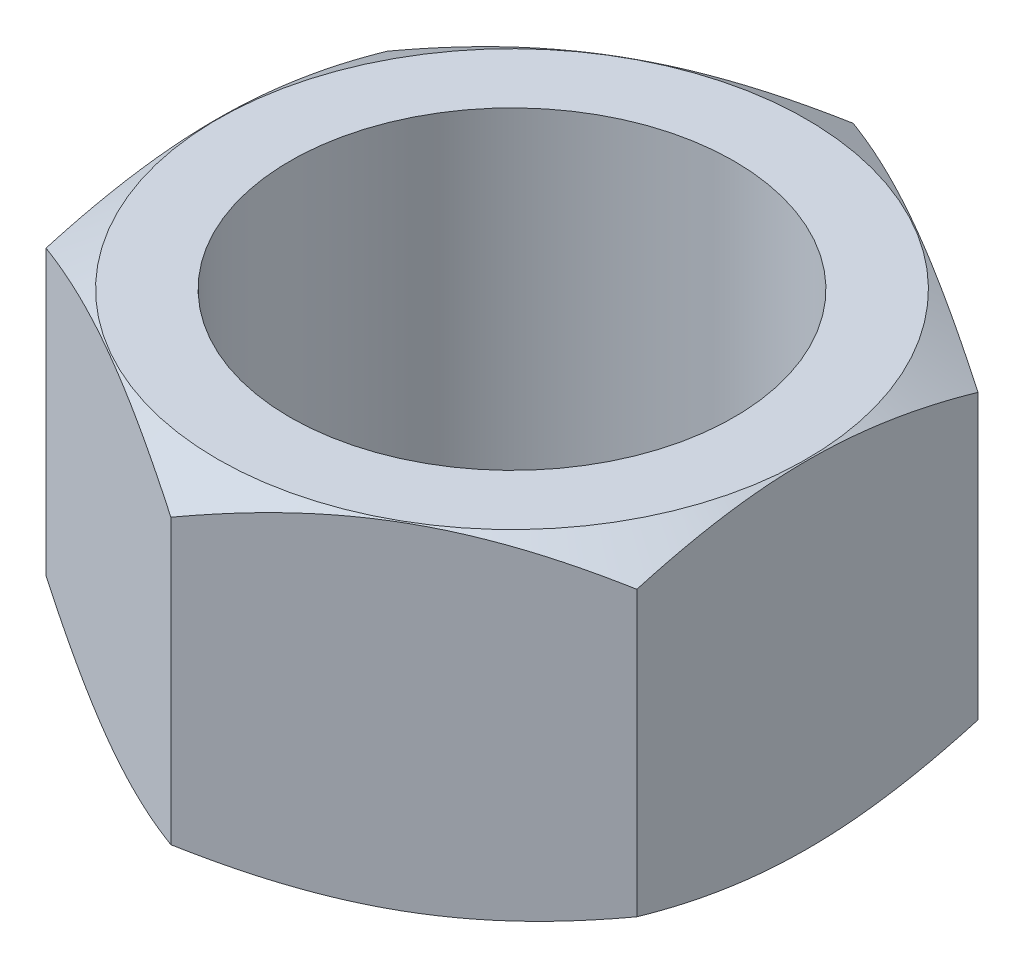
from build123d import *

# Parameters (mm, degrees)
SKETCH2_R           = 0.1315
BOSS_EXTRUDE1_DEPTH = 0.1
SKETCH3_OUTSIDE_W   = 3.156
SKETCH3_OUTSIDE_H   = 3.21
SKETCH3_OUTSIDE_R   = 0.174435158
CUT_EXTRUDE1_DEPTH  = 0.2
CUT_EXTRUDE1_DRAFT  = -60
SKETCH4_OUTSIDE_W   = 3.156
SKETCH4_OUTSIDE_H   = 3.21
SKETCH4_OUTSIDE_R   = 0.174320946
CUT_EXTRUDE2_DEPTH  = 0.2
CUT_EXTRUDE2_DRAFT  = -60


with BuildPart() as part:
    # Sketch2 → Boss-Extrude1 (new, symmetric)
    with BuildSketch(Plane(origin=(0, 0, 0), x_dir=(1, 0, 0), z_dir=(0, 1, 0))):
        Polygon((0, -0.202072594), (0.175, -0.101036297), (0.175, 0.101036297), (0, 0.202072594), (-0.175, 0.101036297), (-0.175, -0.101036297), align=None)
        with Locations(Location((0, 0, 0), (0, 0, 270))):
            Circle(SKETCH2_R, mode=Mode.SUBTRACT)
    extrude(amount=BOSS_EXTRUDE1_DEPTH, both=True)


with BuildPart() as cut_extrude1_tool:
    # Sketch3 outside → Cut-Extrude1 (with draft: the straight prism first)
    with BuildSketch(Plane(origin=(0, 0.1, 0), x_dir=(1, 0, 0), z_dir=(0, 1, 0))):
        Rectangle(SKETCH3_OUTSIDE_W, SKETCH3_OUTSIDE_H)
        Circle(SKETCH3_OUTSIDE_R, mode=Mode.SUBTRACT)
    extrude(amount=-CUT_EXTRUDE1_DEPTH)
    # Cut-Extrude1: the draft: its side faces are tilted about the plane it starts from
    cut_extrude1_sides = [cut_extrude1_tool.faces().sort_by_distance(p)[0] for p in [
        (0, 0, 1.605),
        (1.578, 0, 0),
        (0, 0, -1.605),
        (-1.578, 0, 0),
        (-0.174435158, 0, 0),
    ]]
    draft(cut_extrude1_sides, Plane(origin=(0, 0.1, 0), x_dir=(1, 0, 0), z_dir=(0, 1, 0)), CUT_EXTRUDE1_DRAFT)


with BuildPart() as part_1:
    add(part.part)

    # Cut-Extrude1: cut by cut_extrude1_tool
    add(cut_extrude1_tool.part, mode=Mode.SUBTRACT)


with BuildPart() as cut_extrude2_tool:
    # Sketch4 outside → Cut-Extrude2 (with draft: the straight prism first)
    with BuildSketch(Plane.XZ.offset(0.1)):
        Rectangle(SKETCH4_OUTSIDE_W, SKETCH4_OUTSIDE_H)
        Circle(SKETCH4_OUTSIDE_R, mode=Mode.SUBTRACT)
    extrude(amount=-CUT_EXTRUDE2_DEPTH)
    # Cut-Extrude2: the draft: its side faces are tilted about the plane it starts from
    cut_extrude2_sides = [cut_extrude2_tool.faces().sort_by_distance(p)[0] for p in [
        (0, 0, -1.605),
        (1.578, 0, 0),
        (0, 0, 1.605),
        (-1.578, 0, 0),
        (-0.174320946, 0, 0),
    ]]
    draft(cut_extrude2_sides, Plane.XZ.offset(0.1), CUT_EXTRUDE2_DRAFT)


with BuildPart() as part_2:
    add(part_1.part)

    # Cut-Extrude2: cut by cut_extrude2_tool
    add(cut_extrude2_tool.part, mode=Mode.SUBTRACT)


solid = part_2.part
